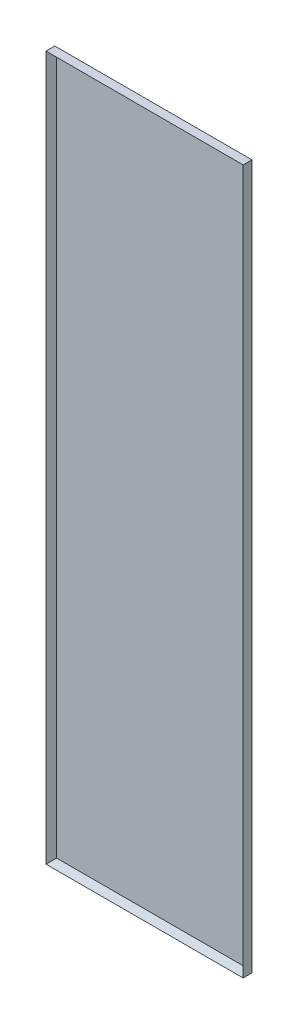
from build123d import *

# Parameters (mm, degrees)
SKETCH2_W           = 560
SKETCH2_H           = 2000
BOSS_EXTRUDE1_DEPTH = 25
SKETCH4_W           = 560
SKETCH4_H           = 2000
CUT_EXTRUDE1_DEPTH  = 15
CUT_EXTRUDE1_DRAFT  = -45


with BuildPart() as part:
    # Sketch2 → Boss-Extrude1 (new body)
    with BuildSketch(Plane.XY):
        with Locations((280, 1000)):
            Rectangle(SKETCH2_W, SKETCH2_H)
    extrude(amount=BOSS_EXTRUDE1_DEPTH)


with BuildPart() as cut_extrude1_tool:
    # Sketch4 → Cut-Extrude1 (with draft: the straight prism first)
    with BuildSketch(Plane.XY.offset(25)):
        with Locations((280, 1000)):
            Rectangle(SKETCH4_W, SKETCH4_H)
    extrude(amount=-CUT_EXTRUDE1_DEPTH)
    # Cut-Extrude1: the draft: its side faces are tilted about the plane it starts from
    cut_extrude1_sides = [cut_extrude1_tool.faces().sort_by_distance(p)[0] for p in [
        (0, 1000, 17.5),
        (280, 0, 17.5),
        (560, 1000, 17.5),
        (280, 2000, 17.5),
    ]]
    draft(cut_extrude1_sides, Plane.XY.offset(25), CUT_EXTRUDE1_DRAFT)


with BuildPart() as part_1:
    add(part.part)

    # Cut-Extrude1: cut by cut_extrude1_tool
    add(cut_extrude1_tool.part, mode=Mode.SUBTRACT)


solid = part_1.part
